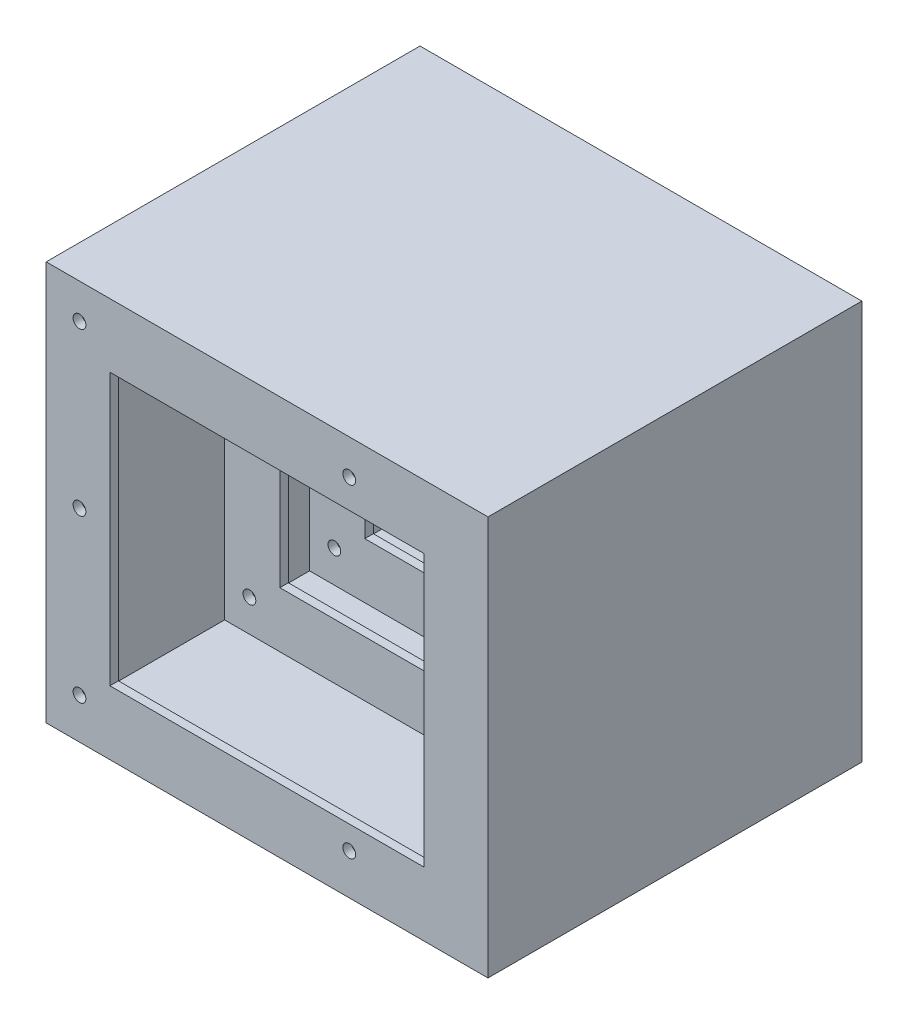
from build123d import *

# Parameters (mm, degrees)
SKETCH3_W           = 104
SKETCH3_H           = 94
SKETCH3_W_2         = 100
SKETCH3_H_2         = 90
EXTRUDE_THIN1_DEPTH = 86
SKETCH3_2_W         = 100
SKETCH3_2_H         = 90
BOSS_EXTRUDE1_DEPTH = 2
SKETCH6_W           = 104
SKETCH6_H           = 94
SKETCH6_W_2         = 73.912331144
SKETCH6_H_2         = 63.926876015
BOSS_EXTRUDE2_DEPTH = 2
LPATTERN1_COUNT     = 2
LPATTERN1_PITCH     = 40
LPATTERN2_COUNT     = 2
LPATTERN2_PITCH     = 60
CUT_EXTRUDE1_REACH  = 134.868
SKETCH9_R           = 1.5
SKETCH10_W          = 18
SKETCH10_H          = 40
BOSS_EXTRUDE3_DEPTH = 8.5
SKETCH12_W          = 35
SKETCH12_H          = 6
CUT_EXTRUDE2_DEPTH  = 65.5


with BuildPart() as part:
    # Sketch3 → Extrude-Thin1 (new body)
    with BuildSketch(Plane.XY):
        with Locations((18.667779633, -23.113522538)):
            Rectangle(SKETCH3_W, SKETCH3_H)
        with Locations((18.667779633, -23.113522538)):
            Rectangle(SKETCH3_W_2, SKETCH3_H_2, mode=Mode.SUBTRACT)
    extrude(amount=EXTRUDE_THIN1_DEPTH)

    # Sketch3<2> → Boss-Extrude1 (add)
    with BuildSketch(Plane.XY):
        with Locations((18.667779633, -23.113522538)):
            Rectangle(SKETCH3_2_W, SKETCH3_2_H)
    extrude(amount=BOSS_EXTRUDE1_DEPTH)

    # Sketch6 → Boss-Extrude2 (add)
    with BuildSketch(Plane.XY.offset(86)):
        with Locations((18.667779633, -23.113522538)):
            Rectangle(SKETCH6_W, SKETCH6_H)
        with Locations((18.623945205, -23.076960546)):
            Rectangle(SKETCH6_W_2, SKETCH6_H_2, mode=Mode.SUBTRACT)
    boss_extrude2 = extrude(amount=BOSS_EXTRUDE2_DEPTH)

    # LPattern1: Boss-Extrude2 ×2
    with Locations(*[(0, 0, -i * LPATTERN1_PITCH) for i in range(1, LPATTERN1_COUNT)]):
        add(boss_extrude2)

    # LPattern2: Boss-Extrude2 ×2
    with Locations(*[(0, 0, -i * LPATTERN2_PITCH) for i in range(1, LPATTERN2_COUNT)]):
        add(boss_extrude2)

    # Cut-Extrude1: up to this face of the body (flat: up to its plane)
    cut_extrude1_end = Plane(part.part.faces().sort_by_distance((18.667779633, -23.113522538, 2))[0])
    # Sketch9 → Cut-Extrude1 (cut, up to the picked face)
    with BuildSketch(Plane.XY.offset(88), mode=Mode.PRIVATE) as cut_extrude1_sk1:
        with Locations((-25.492242635, 15.664652421)):
            Circle(SKETCH9_R)
    cut_extrude1_tool1 = split(extrude(cut_extrude1_sk1.sketch, amount=-CUT_EXTRUDE1_REACH, mode=Mode.PRIVATE), bisect_by=cut_extrude1_end, keep=Keep.BOTH, mode=Mode.PRIVATE)
    # Sketch9 → Cut-Extrude1 (cut, up to the picked face)
    with BuildSketch(Plane.XY.offset(88), mode=Mode.PRIVATE) as cut_extrude1_sk2:
        with Locations((38.007757365, 15.664652421)):
            Circle(SKETCH9_R)
    cut_extrude1_tool2 = split(extrude(cut_extrude1_sk2.sketch, amount=-CUT_EXTRUDE1_REACH, mode=Mode.PRIVATE), bisect_by=cut_extrude1_end, keep=Keep.BOTH, mode=Mode.PRIVATE)
    # Sketch9 → Cut-Extrude1 (cut, up to the picked face)
    with BuildSketch(Plane.XY.offset(88), mode=Mode.PRIVATE) as cut_extrude1_sk3:
        with Locations((38.007757365, -22.435347579)):
            Circle(SKETCH9_R)
    cut_extrude1_tool3 = split(extrude(cut_extrude1_sk3.sketch, amount=-CUT_EXTRUDE1_REACH, mode=Mode.PRIVATE), bisect_by=cut_extrude1_end, keep=Keep.BOTH, mode=Mode.PRIVATE)
    # Sketch9 → Cut-Extrude1 (cut, up to the picked face)
    with BuildSketch(Plane.XY.offset(88), mode=Mode.PRIVATE) as cut_extrude1_sk4:
        with Locations((38.007757365, -60.535347579)):
            Circle(SKETCH9_R)
    cut_extrude1_tool4 = split(extrude(cut_extrude1_sk4.sketch, amount=-CUT_EXTRUDE1_REACH, mode=Mode.PRIVATE), bisect_by=cut_extrude1_end, keep=Keep.BOTH, mode=Mode.PRIVATE)
    # Sketch9 → Cut-Extrude1 (cut, up to the picked face)
    with BuildSketch(Plane.XY.offset(88), mode=Mode.PRIVATE) as cut_extrude1_sk5:
        with Locations((-25.492242635, -22.435347579)):
            Circle(SKETCH9_R)
    cut_extrude1_tool5 = split(extrude(cut_extrude1_sk5.sketch, amount=-CUT_EXTRUDE1_REACH, mode=Mode.PRIVATE), bisect_by=cut_extrude1_end, keep=Keep.BOTH, mode=Mode.PRIVATE)
    # Sketch9 → Cut-Extrude1 (cut, up to the picked face)
    with BuildSketch(Plane.XY.offset(88), mode=Mode.PRIVATE) as cut_extrude1_sk6:
        with Locations((-25.492242635, -60.535347579)):
            Circle(SKETCH9_R)
    cut_extrude1_tool6 = split(extrude(cut_extrude1_sk6.sketch, amount=-CUT_EXTRUDE1_REACH, mode=Mode.PRIVATE), bisect_by=cut_extrude1_end, keep=Keep.BOTH, mode=Mode.PRIVATE)
    add(cut_extrude1_tool1.solids().sort_by(Axis((-25.492243, 15.664652, 88), (0, 0, -1)))[0], mode=Mode.SUBTRACT)
    add(cut_extrude1_tool2.solids().sort_by(Axis((38.007757, 15.664652, 88), (0, 0, -1)))[0], mode=Mode.SUBTRACT)
    add(cut_extrude1_tool3.solids().sort_by(Axis((38.007757, -22.435348, 88), (0, 0, -1)))[0], mode=Mode.SUBTRACT)
    add(cut_extrude1_tool4.solids().sort_by(Axis((38.007757, -60.535348, 88), (0, 0, -1)))[0], mode=Mode.SUBTRACT)
    add(cut_extrude1_tool5.solids().sort_by(Axis((-25.492243, -22.435348, 88), (0, 0, -1)))[0], mode=Mode.SUBTRACT)
    add(cut_extrude1_tool6.solids().sort_by(Axis((-25.492243, -60.535348, 88), (0, 0, -1)))[0], mode=Mode.SUBTRACT)

    # Sketch10 → Boss-Extrude3 (add)
    with BuildSketch(Plane.XZ.offset(70.113522538)):
        with Locations((-5.791529817, 49.453628138)):
            Rectangle(SKETCH10_W, SKETCH10_H)
        with Locations((39.794952927, 49.453628138)):
            Rectangle(SKETCH10_W, SKETCH10_H)
    extrude(amount=BOSS_EXTRUDE3_DEPTH)

    # Sketch12 → Cut-Extrude2 (cut)
    with BuildSketch(Plane(origin=(48.794952927, 0, 0), x_dir=(0, 0, -1), z_dir=(1, 0, 0))):
        with Locations((-49.453628138, -73.113522538)):
            Rectangle(SKETCH12_W, SKETCH12_H)
    extrude(amount=-CUT_EXTRUDE2_DEPTH, mode=Mode.SUBTRACT)


solid = part.part
